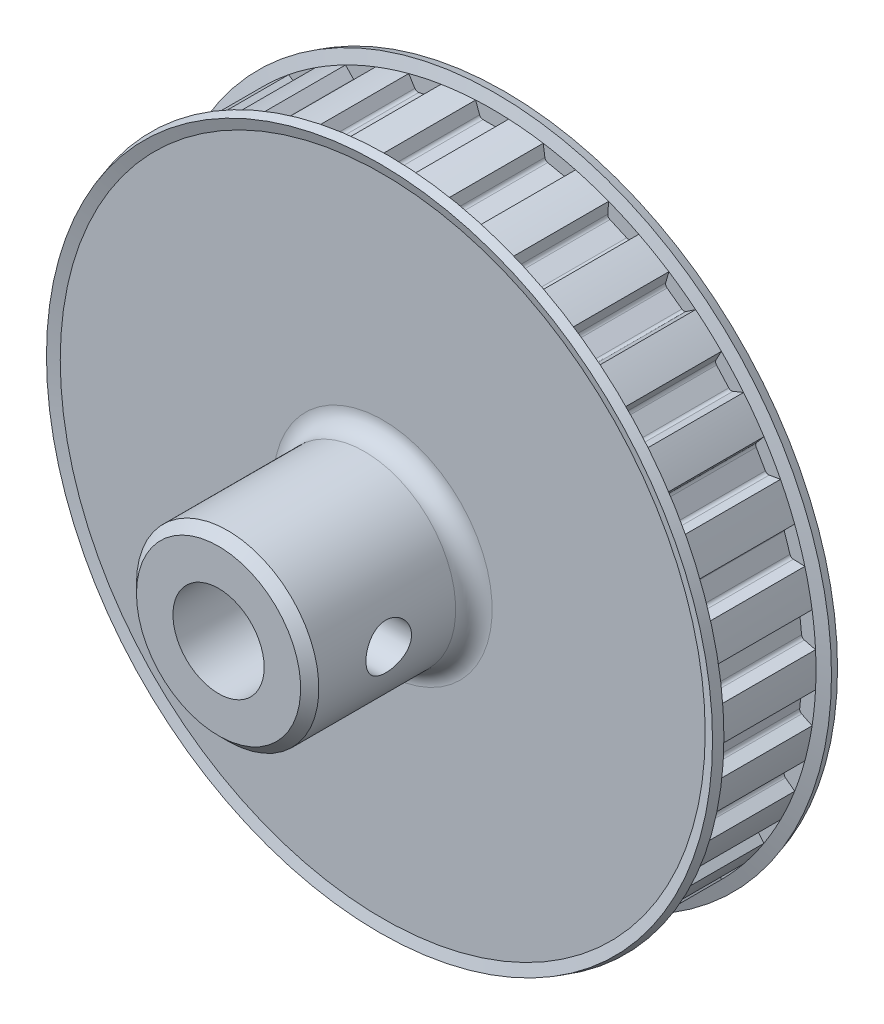
from build123d import *

# Parameters (mm, degrees)
SKETCH1_R               = 45.0977
BASEPULLEY_DEPTH        = 13.97
GROOVE_DEPTH            = 6.985
GROOVES_COUNT           = 30
GROOVES_ANGLE           = 348
SKETCH4_W               = 24.13
SKETCH4_H               = 12.7
BORSKE_R                = 6.35
BORE_DEPTH              = 78.178080042
CUT_EXTRUDE1_DEPTH      = 71.378539367
CUT_EXTRUDE1_DEPTH_BACK = 71.378539367
SKETCH5_R               = 3.175
FILLET1_R               = 2.54
CHAMFER1_SIZE           = 1.27


with BuildPart() as part:
    # Sketch1 → BasePulley (new body)
    with BuildSketch(Plane.XY):
        Circle(SKETCH1_R)
    extrude(amount=-BASEPULLEY_DEPTH)

    # Sketch2 → Flange (revolve)
    with BuildSketch(Plane(origin=(0, 0, 0), x_dir=(0, 0, -1), z_dir=(1, 0, 0)), mode=Mode.PRIVATE) as flange_sk:
        Polygon((13.97, 45.0977), (14.474761355, 46.7487), (15.689268395, 46.377387935), (15.24, 44.907897228), (15.24, 0), (-1.27, 0), (-1.27, 44.907897228), (-1.719268395, 46.377387935), (-0.504761355, 46.7487), (0, 45.0977), align=None)
    revolve(flange_sk.sketch.rotate(Axis((0, 0, 0), (0, 0, -1)), 90), axis=Axis((0, 0, 0), (0, 0, -1)))

    # Sketch3 → Groove (cut, symmetric)
    with BuildSketch(Plane.XY.offset(-6.985)):
        with BuildLine():
            Line((-2.3241, 45.0977), (-2.3241, 70.4977))
            Line((-2.3241, 70.4977), (2.3241, 70.4977))
            Line((2.3241, 70.4977), (2.3241, 45.0977))
            Line((2.3241, 45.0977), (1.752395126, 43.526953767))
            ThreePointArc((1.752395126, 43.526953767), (1.566408104, 43.284570762), (1.275031274, 43.1927))
            Line((1.275031274, 43.1927), (-1.275031274, 43.1927))
            ThreePointArc((-1.275031274, 43.1927), (-1.566408104, 43.284570762), (-1.752395126, 43.526953767))
            Line((-1.752395126, 43.526953767), (-2.3241, 45.0977))
        make_face()
    groove = extrude(amount=GROOVE_DEPTH, both=True, mode=Mode.SUBTRACT)

    # Grooves: Groove ×30 about axis
    grooves_axis = Axis((0, 0, -13.97), (0, 0, 1))
    for i in range(1, GROOVES_COUNT):
        add(groove.rotate(grooves_axis, i * GROOVES_ANGLE / (GROOVES_COUNT - 1)), mode=Mode.SUBTRACT)

    # Sketch4 → BaseHub (revolve)
    with BuildSketch(Plane(origin=(0, 0, 0), x_dir=(0, 0, -1), z_dir=(1, 0, 0)), mode=Mode.PRIVATE) as basehub_sk:
        with Locations((-12.065, 6.35)):
            Rectangle(SKETCH4_W, SKETCH4_H)
    revolve(basehub_sk.sketch.rotate(Axis((0, 0, 0), (0, 0, -1)), 273.073204151), axis=Axis((0, 0, 0), (0, 0, -1)))

    # BorSke → Bore (cut, through all)
    with BuildSketch(Plane.XY.offset(24.13)):
        Circle(BORSKE_R)
    extrude(amount=-BORE_DEPTH, mode=Mode.SUBTRACT)

    # Sketch5 → Cut-Extrude1 (cut, two sides: drawn at the far end of the back side and taken through both)
    with BuildSketch(Plane(origin=(0, 0, 0), x_dir=(0, 0, -1), z_dir=(1, 0, 0)).offset(-CUT_EXTRUDE1_DEPTH_BACK)):
        with Locations((-13.132528872, 0)):
            Circle(SKETCH5_R)
    extrude(amount=CUT_EXTRUDE1_DEPTH + CUT_EXTRUDE1_DEPTH_BACK, mode=Mode.SUBTRACT)

    # Fillet1
    fillet1_edges = [part.edges().sort_by_distance(p)[0] for p in [
        (12.681735526, -0.680870059, 1.27),
    ]]
    fillet(fillet1_edges, radius=FILLET1_R)

    # Chamfer1
    chamfer1_edges = [part.edges().sort_by_distance(p)[0] for p in [
        (12.681735526, -0.680870059, 24.13),
    ]]
    chamfer(chamfer1_edges, length=CHAMFER1_SIZE)


solid = part.part
